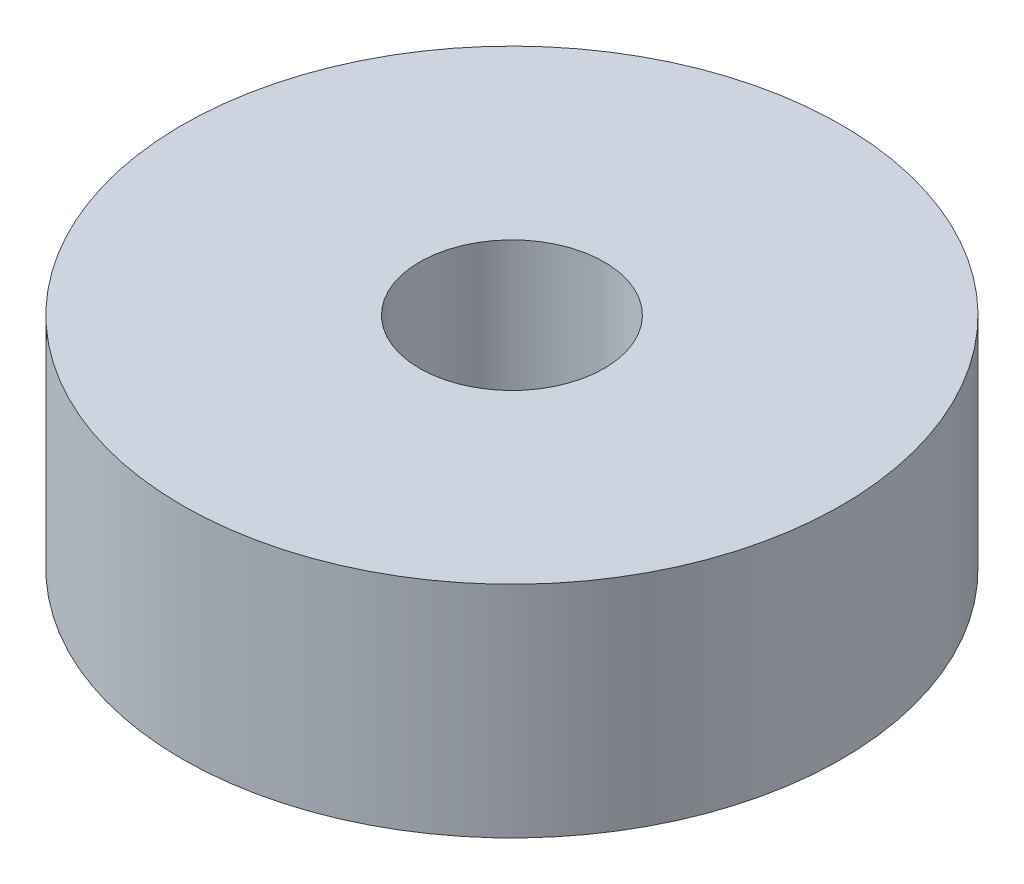
from build123d import *

# Parameters (mm, degrees)
SKETCH_1_R      = 7.5
SKETCH_1_R_2    = 2.1
EXTRUDE_1_DEPTH = 5


with BuildPart() as part:
    # 草图1 → 凸台-拉伸1 (new body)
    with BuildSketch(Plane(origin=(0, 0, 0), x_dir=(1, 0, 0), z_dir=(0, 1, 0))):
        with Locations(Location((0, 0, 0), (0, 0, 270))):
            Circle(SKETCH_1_R)
        with Locations(Location((0, 0, 0), (0, 0, 270))):
            Circle(SKETCH_1_R_2, mode=Mode.SUBTRACT)
    extrude(amount=EXTRUDE_1_DEPTH)


solid = part.part
